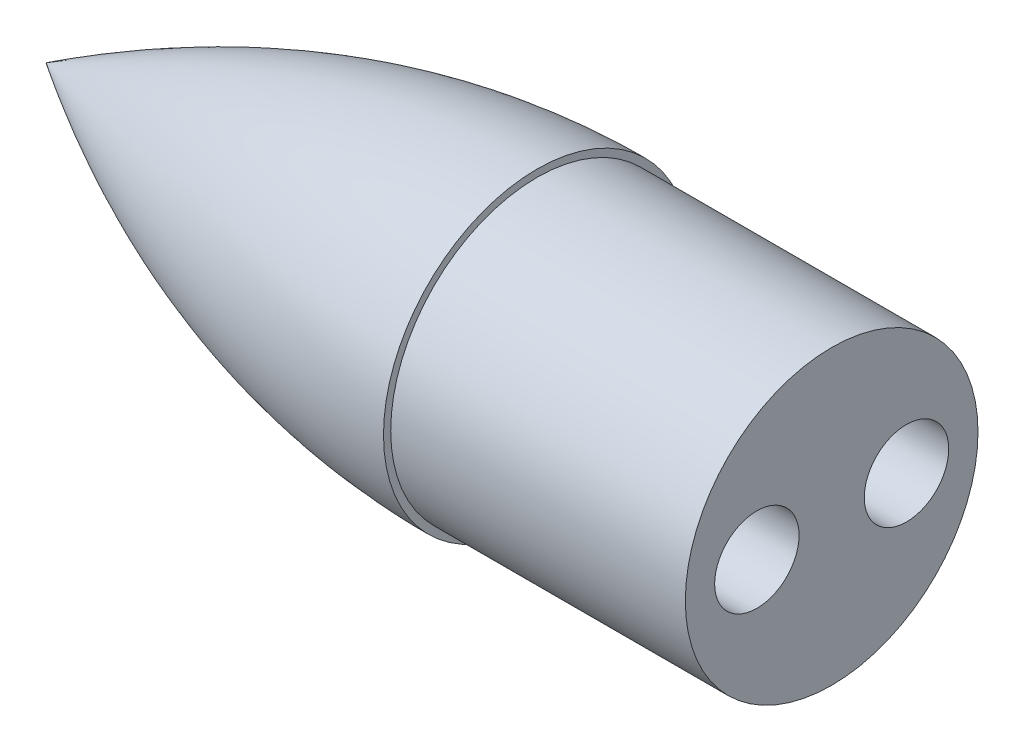
from build123d import *

# Parameters (mm, degrees)
SKETCH2_R           = 37.846
BOSS_EXTRUDE1_DEPTH = 50.8
SKETCH3_R           = 10.922
SKETCH4_R           = 37.846
SKETCH4_R_2         = 10.922
BOSS_EXTRUDE2_DEPTH = 25.4


with BuildPart() as part:
    # Sketch1 → Revolve1 (revolve)
    with BuildSketch(Plane.XY):
        with BuildLine():
            Line((126.999999998, 0), (126.999999998, 39.712900001))
            add(Edge.make_bspline(
                [(-1e-09, 0), (63.499999999, 39.7129), (126.999999998, 39.712900001)],
                knots=[0.074879484, 0.074879484, 0.074879484, 0.915898135, 0.915898135, 0.915898135], degree=2))
            Line((-1e-09, 0), (126.999999998, 0))
        make_face()
    revolve(axis=Axis((-1e-09, 0, 0), (1, 0, 0)))

    # Sketch2 → Boss-Extrude1 (add)
    with BuildSketch(Plane(origin=(126.999999998, 0, 0), x_dir=(0, 0, -1), z_dir=(1, 0, 0))):
        Circle(SKETCH2_R)
    extrude(amount=BOSS_EXTRUDE1_DEPTH)

    # Sketch3 → Cut-Revolve1 (revolve, cut)
    with BuildSketch(Plane(origin=(177.799999998, 0, 0), x_dir=(0, 0, -1), z_dir=(1, 0, 0))):
        with Locations((-19.347570256, 0)):
            Circle(SKETCH3_R)
    revolve(axis=Axis((177.799999998, 0, 0), (0, 1, 0)), mode=Mode.SUBTRACT)

    # Sketch4 → Boss-Extrude2 (add)
    with BuildSketch(Plane(origin=(177.799999998, 0, 0), x_dir=(0, 0, -1), z_dir=(1, 0, 0))):
        Circle(SKETCH4_R)
        with Locations((-19.347570256, 0)):
            Circle(SKETCH4_R_2, mode=Mode.SUBTRACT)
        with Locations((19.347570256, 0)):
            Circle(SKETCH4_R_2, mode=Mode.SUBTRACT)
    extrude(amount=BOSS_EXTRUDE2_DEPTH)


solid = part.part
